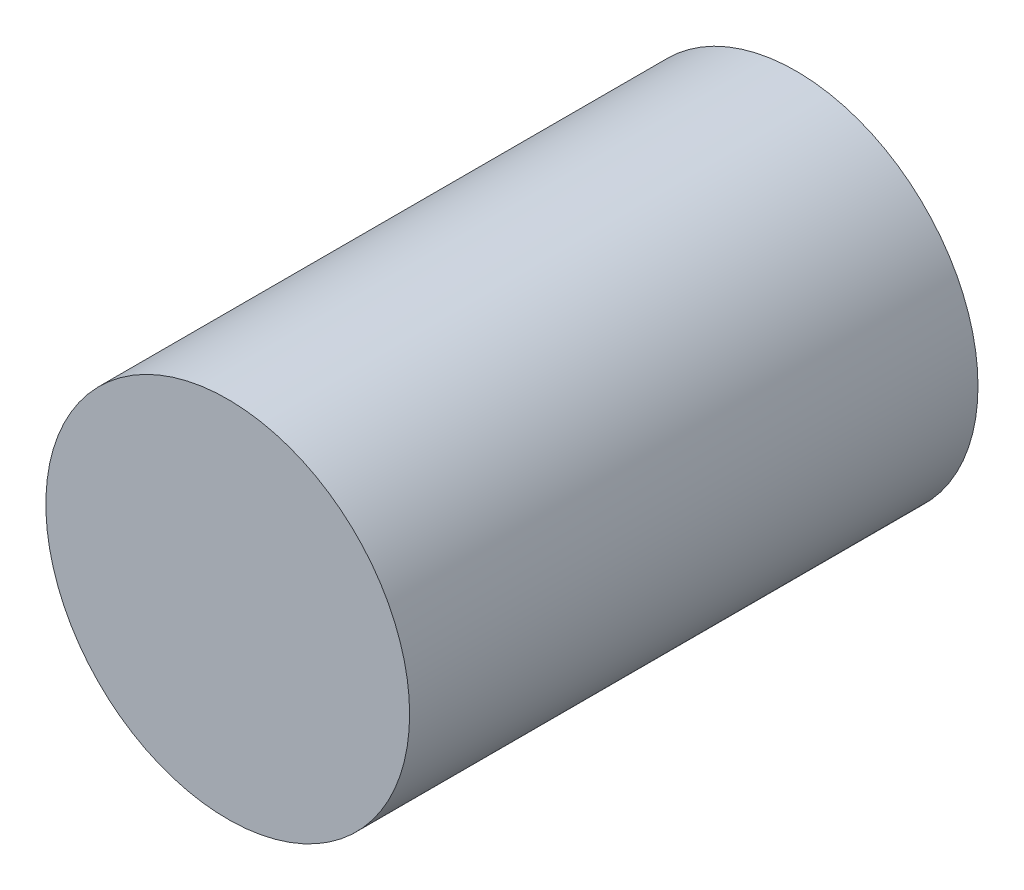
from build123d import *

# Parameters (mm, degrees)
SKETCH1_R           = 4.064
BOSS_EXTRUDE1_DEPTH = 12.7


with BuildPart() as part:
    # Sketch1 → Boss-Extrude1 (new body)
    with BuildSketch(Plane.XY):
        Circle(SKETCH1_R)
    extrude(amount=BOSS_EXTRUDE1_DEPTH)


solid = part.part
